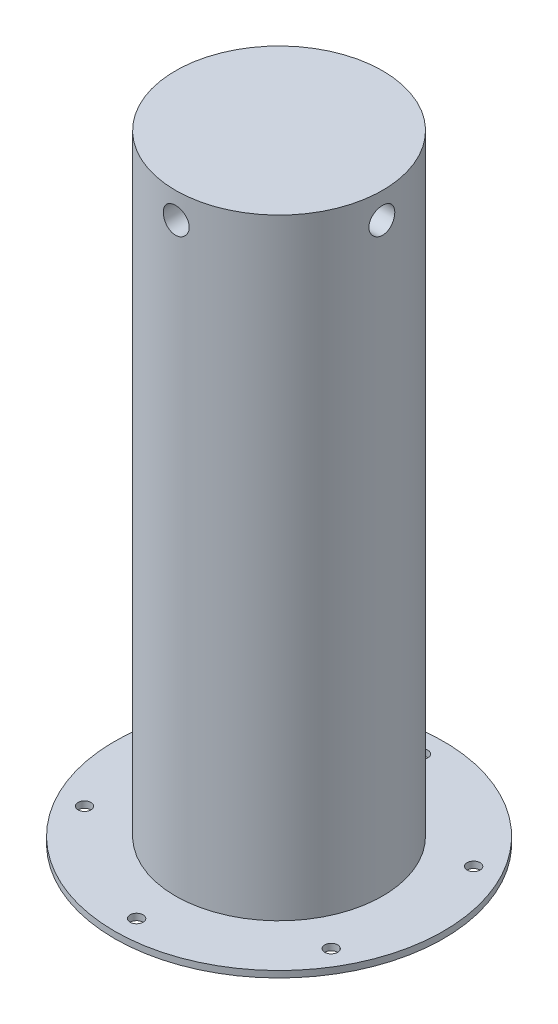
from build123d import *

# Parameters (mm, degrees)
BOSS_EXTRUDE1_START     = 8.89
SKETCH4_R               = 101.6
BOSS_EXTRUDE1_DEPTH     = 8.89
CUT_EXTRUDE2_DEPTH      = 642.371375881
CUT_EXTRUDE2_DEPTH_BACK = 642.371375881
SKETCH5_R               = 12.7
CUT_EXTRUDE3_DEPTH      = 642.371375975
CUT_EXTRUDE3_DEPTH_BACK = 642.371375975
SKETCH6_R               = 12.7
SKETCH7_R               = 6.35
CUT_EXTRUDE4_DEPTH      = 648.310167092


with BuildPart() as part:
    # Sketch2 → Revolve1 (revolve)
    with BuildSketch(Plane.XY, mode=Mode.PRIVATE) as revolve1_sk:
        Polygon((101.6, 0), (101.6, 590.55), (0, 590.55), (0, 0), (0, -6.35), (161.29, -6.35), (161.29, 0), align=None)
    revolve(revolve1_sk.sketch.rotate(Axis((0, 590.55, 0), (0, -1, 0)), 90), axis=Axis((0, 590.55, 0), (0, -1, 0)))

    # Sketch4 → Boss-Extrude1 (add)
    with BuildSketch(Plane(origin=(0, 590.55, 0), x_dir=(1, 0, 0), z_dir=(0, 1, 0)).offset(BOSS_EXTRUDE1_START)):
        with Locations(Location((0, 0, 0), (0, 0, 270))):
            Circle(SKETCH4_R)
    extrude(amount=-BOSS_EXTRUDE1_DEPTH)

    # Sketch5 → Cut-Extrude2 (cut, two sides: drawn at the far end of the back side and taken through both)
    with BuildSketch(Plane(origin=(0, 0, 0), x_dir=(0, 0, -1), z_dir=(1, 0, 0)).offset(-CUT_EXTRUDE2_DEPTH_BACK)):
        with Locations((0, 574.04)):
            Circle(SKETCH5_R)
    extrude(amount=CUT_EXTRUDE2_DEPTH + CUT_EXTRUDE2_DEPTH_BACK, mode=Mode.SUBTRACT)

    # Sketch6 → Cut-Extrude3 (cut, two sides: drawn at the far end of the back side and taken through both)
    with BuildSketch(Plane.XY.offset(-CUT_EXTRUDE3_DEPTH_BACK)):
        with Locations(Location((0, 574.04, 0), (0, 0, 270))):
            Circle(SKETCH6_R)
    extrude(amount=CUT_EXTRUDE3_DEPTH + CUT_EXTRUDE3_DEPTH_BACK, mode=Mode.SUBTRACT)

    # Sketch7 → Cut-Extrude4 (cut, through all)
    with BuildSketch(Plane.XZ.offset(6.35)):
        with Locations(Location((0, 139.7, 0), (0, 0, 270))):
            Circle(SKETCH7_R)
        with Locations(Location((120.983748909, 69.85, 0), (0, 0, 270))):
            Circle(SKETCH7_R)
        with Locations(Location((120.983748909, -69.85, 0), (0, 0, 270))):
            Circle(SKETCH7_R)
        with Locations(Location((0, -139.7, 0), (0, 0, 270))):
            Circle(SKETCH7_R)
        with Locations(Location((-120.983748909, -69.85, 0), (0, 0, 270))):
            Circle(SKETCH7_R)
        with Locations(Location((-120.983748909, 69.85, 0), (0, 0, 270))):
            Circle(SKETCH7_R)
    extrude(amount=-CUT_EXTRUDE4_DEPTH, mode=Mode.SUBTRACT)


solid = part.part
